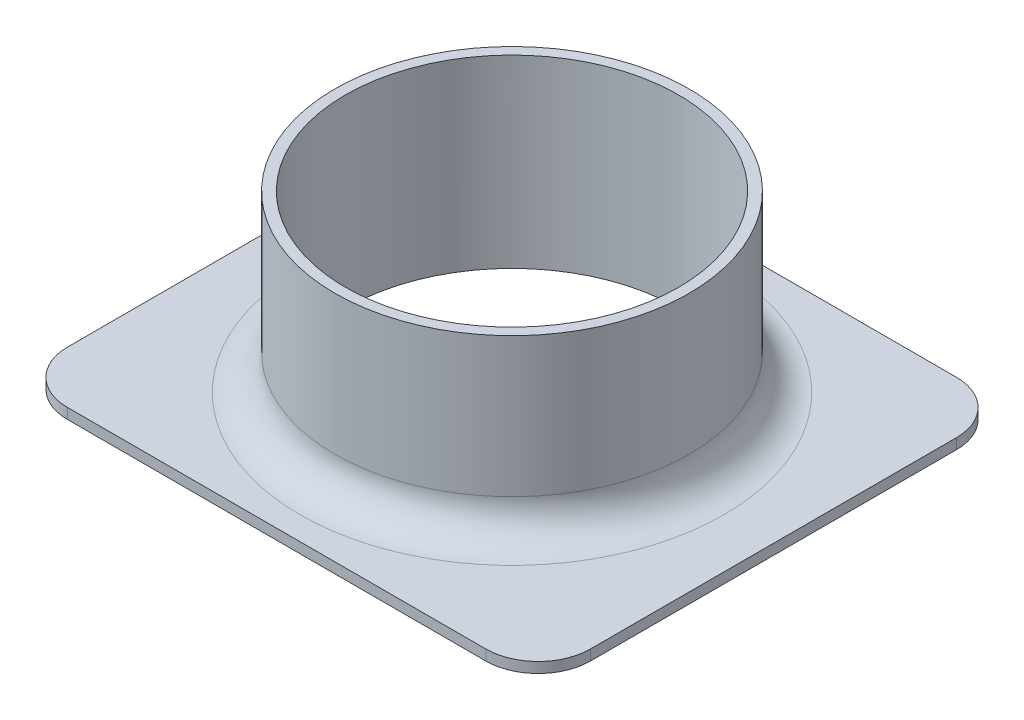
from build123d import *

# Parameters (mm, degrees)
ESBO_O1_R                = 50.8
ESBO_O1_R_2              = 47.8
EXTRUS_O_FINA1_DEPTH     = 50
ESBO_O2_W                = 150
ESBO_O2_H                = 135
RESSALTO_EXTRUS_O1_DEPTH = 3
FILETE1_R                = 10
FILETE2_R                = 15
ESBO_O3_R                = 47.8
CORTE_EXTRUS_O1_DEPTH    = 113.611056296


with BuildPart() as part:
    # Esboço1 → Extrusão-Fina1 (new body)
    with BuildSketch(Plane(origin=(0, 0, 0), x_dir=(1, 0, 0), z_dir=(0, 1, 0))):
        Circle(ESBO_O1_R)
        Circle(ESBO_O1_R_2, mode=Mode.SUBTRACT)
    extrude(amount=EXTRUS_O_FINA1_DEPTH)

    # Esboço2 → Ressalto-extrusão1 (add)
    with BuildSketch(Plane.XZ):
        Rectangle(ESBO_O2_W, ESBO_O2_H)
    extrude(amount=RESSALTO_EXTRUS_O1_DEPTH)

    # Filete1
    filete1_edges = [part.edges().sort_by_distance(p)[0] for p in [
        (-50.8, 0, 0),
    ]]
    fillet(filete1_edges, radius=FILETE1_R)

    # Filete2
    filete2_edges = [part.edges().sort_by_distance(p)[0] for p in [
        (-75, -1.5, -67.5),
        (75, -1.5, -67.5),
        (75, -1.5, 67.5),
        (-75, -1.5, 67.5),
    ]]
    fillet(filete2_edges, radius=FILETE2_R)

    # Esboço3 → Corte-extrusão1 (cut, through all)
    with BuildSketch(Plane(origin=(0, 0, 0), x_dir=(1, 0, 0), z_dir=(0, 1, 0))):
        Circle(ESBO_O3_R)
    extrude(amount=-CORTE_EXTRUS_O1_DEPTH, mode=Mode.SUBTRACT)


solid = part.part
